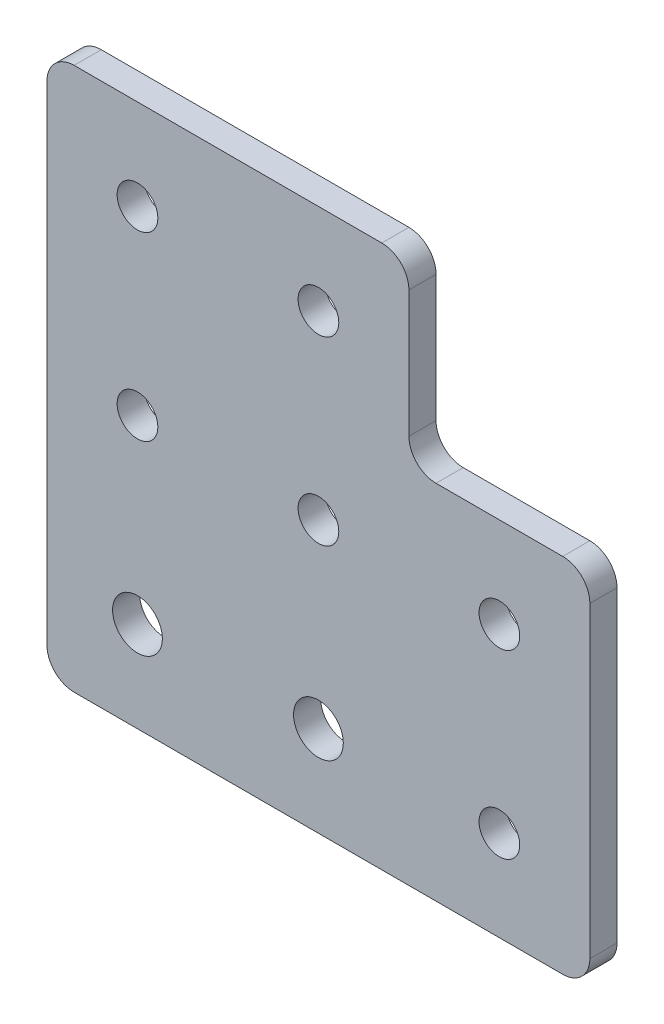
from build123d import *

# Parameters (mm, degrees)
SZKIC1_R                    = 2.75
SZKIC1_R_2                  = 2.25
DODANIE_WYCI_GNI_CIE1_DEPTH = 3
ZAOKR_GLENIE1_R             = 3
ZAOKR_GLENIE2_R             = 3


with BuildPart() as part:
    # Szkic1 → Dodanie-wyciągnięcie1 (new body)
    with BuildSketch(Plane.XY):
        Polygon((8.371402008, 50.388834407), (-31.628597992, 50.388834407), (-31.628597992, 10.388834407), (-31.628597992, -9.611165593), (-11.628597992, -9.611165593), (28.371402008, -9.611165593), (28.371402008, 30.388834407), (8.371402008, 30.388834407), align=None)
        with Locations((-21.628597992, 0.388834407)):
            Circle(SZKIC1_R, mode=Mode.SUBTRACT)
        with Locations((-1.628597992, 0.388834407)):
            Circle(SZKIC1_R, mode=Mode.SUBTRACT)
        with Locations((18.371402008, 0.388834407)):
            Circle(SZKIC1_R_2, mode=Mode.SUBTRACT)
        with Locations((-21.628597992, 20.388834407)):
            Circle(SZKIC1_R_2, mode=Mode.SUBTRACT)
        with Locations((-21.628597992, 40.388834407)):
            Circle(SZKIC1_R_2, mode=Mode.SUBTRACT)
        with Locations((-1.628597992, 20.388834407)):
            Circle(SZKIC1_R_2, mode=Mode.SUBTRACT)
        with Locations((18.371402008, 20.388834407)):
            Circle(SZKIC1_R_2, mode=Mode.SUBTRACT)
        with Locations((-1.628597992, 40.388834407)):
            Circle(SZKIC1_R_2, mode=Mode.SUBTRACT)
    extrude(amount=DODANIE_WYCI_GNI_CIE1_DEPTH)

    # Zaokrąglenie1
    zaokr_glenie1_edges = [part.edges().sort_by_distance(p)[0] for p in [
        (-31.628597992, -9.611165593, 1.5),
        (-31.628597992, 50.388834407, 1.5),
        (8.371402008, 50.388834407, 1.5),
        (28.371402008, 30.388834407, 1.5),
        (28.371402008, -9.611165593, 1.5),
    ]]
    fillet(zaokr_glenie1_edges, radius=ZAOKR_GLENIE1_R)

    # Zaokrąglenie2
    zaokr_glenie2_edges = [part.edges().sort_by_distance(p)[0] for p in [
        (8.371402008, 30.388834407, 1.5),
    ]]
    fillet(zaokr_glenie2_edges, radius=ZAOKR_GLENIE2_R)


solid = part.part
